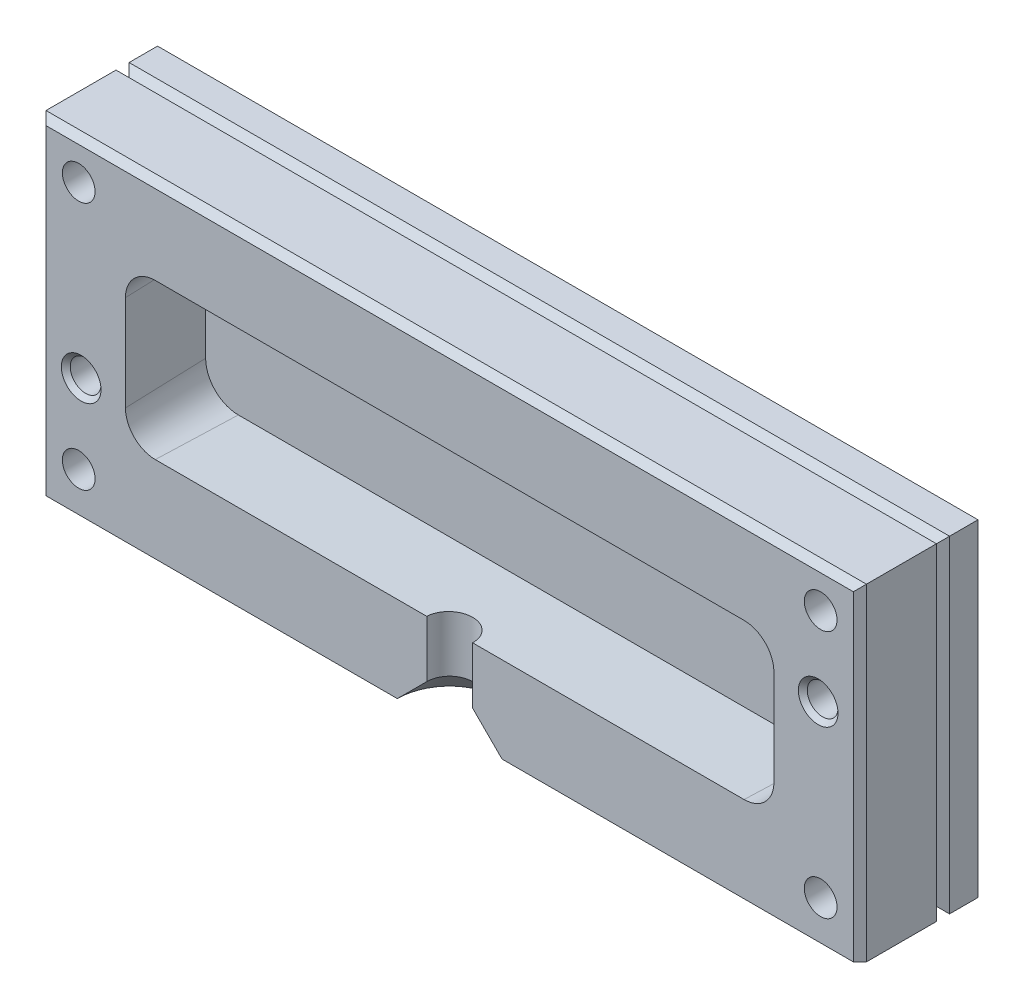
from build123d import *

# Parameters (mm, degrees)
MOLDSKETCH_W                         = 125.4
MOLDSKETCH_H                         = 50
MOLDEXTRUSION12_7MM_DEPTH            = 12.7
COVERSKETCH_W                        = 125.4
COVERSKETCH_H                        = 50
COVERTHICKNESS_DEPTH                 = 6.35
MOLD2DEGDRAFT_ANGLE                  = 2
F_6_0MM_DOWEL_HOLES_AT_2_COUNT       = 2
F_6_0MM_DOWEL_HOLES_AT_2_PITCH       = 113.456037741
CHAMFER1_SIZE                        = 1
SKETCH9_W                            = 2.5
SKETCH9_H                            = 12.7
TAP_DRILL_FOR_M6X1_0_TAP1_AT_2_COUNT = 2
TAP_DRILL_FOR_M6X1_0_TAP1_AT_2_PITCH = 113.4
TAP_DRILL_FOR_M6X1_0_TAP1_AT_3_COUNT = 2
TAP_DRILL_FOR_M6X1_0_TAP1_AT_3_PITCH = 119.597491612
TAP_DRILL_FOR_M6X1_0_TAP1_AT_4_COUNT = 2
TAP_DRILL_FOR_M6X1_0_TAP1_AT_4_PITCH = 38
COVERCHAMFER_SIZE                    = 1
SKETCH11_W                           = 2.5
SKETCH11_H                           = 6.35
TAP_DRILL_FOR_M6X1_0_TAP2_AT_2_COUNT = 2
TAP_DRILL_FOR_M6X1_0_TAP2_AT_2_PITCH = 113.4
TAP_DRILL_FOR_M6X1_0_TAP2_AT_3_COUNT = 2
TAP_DRILL_FOR_M6X1_0_TAP2_AT_3_PITCH = 119.597491612
TAP_DRILL_FOR_M6X1_0_TAP2_AT_4_COUNT = 2
TAP_DRILL_FOR_M6X1_0_TAP2_AT_4_PITCH = 38


with BuildPart() as part:
    # MoldSketch → MoldExtrusion12.7mm (new body)
    with BuildSketch(Plane.XY):
        Rectangle(MOLDSKETCH_W, MOLDSKETCH_H)
        with BuildLine():
            Line((-45, 12.3), (45, 12.3))
            ThreePointArc((45, 12.3), (48.535533906, 10.835533906), (50, 7.3))
            Line((50, 7.3), (50, -7.3))
            ThreePointArc((50, -7.3), (48.535533906, -10.835533906), (45, -12.3))
            Line((45, -12.3), (-45, -12.3))
            ThreePointArc((-45, -12.3), (-48.535533906, -10.835533906), (-50, -7.3))
            Line((-50, -7.3), (-50, 7.3))
            ThreePointArc((-50, 7.3), (-48.535533906, 10.835533906), (-45, 12.3))
        make_face(mode=Mode.SUBTRACT)
    extrude(amount=MOLDEXTRUSION12_7MM_DEPTH)

    # Mold2DegDraft
    mold2degdraft_faces = [part.faces().sort_by_distance(p)[0] for p in [
        (48.535533906, -10.835533906, 6.35),
        (50, 0, 6.35),
        (48.535533906, 10.835533906, 6.35),
        (0, 12.3, 6.35),
        (-48.535533906, 10.835533906, 6.35),
        (-50, 0, 6.35),
        (-48.535533906, -10.835533906, 6.35),
        (0, -12.3, 6.35),
    ]]
    draft(mold2degdraft_faces, Plane(origin=(0, 0, 0), x_dir=(-1, 0, 0), z_dir=(0, 0, -1)), MOLD2DEGDRAFT_ANGLE)

    # Sketch7 → Ø6.0mm Dowel Holes (revolve, cut)
    with BuildSketch(Plane(origin=(-56.325, -6.75, 12.7), x_dir=(0, -1, 0), z_dir=(1, 0, 0))):
        Polygon((0, 0), (0, 9.412022455), (2.35, 8), (2.35, 0.68), (3.03, 0), align=None)
    f_6_0mm_dowel_holes = revolve(axis=Axis((-56.325, -6.75, 19.05), (0, 0, -1)), mode=Mode.SUBTRACT)

    # Ø6.0mm Dowel Holes at 2: Ø6.0mm Dowel Holes ×2
    with Locations(*[Vector(0.9928955941213675, 0.11898881953518381, 0) * (i * F_6_0MM_DOWEL_HOLES_AT_2_PITCH) for i in range(1, F_6_0MM_DOWEL_HOLES_AT_2_COUNT)]):
        add(f_6_0mm_dowel_holes, mode=Mode.SUBTRACT)

    # InjectionHole → CSK for M6 Flat Head Machine Screw1 (revolve, cut)
    with BuildSketch(Plane(origin=(0, -25, 12.7), x_dir=(0, 0, -1), z_dir=(1, 0, 0))):
        Polygon((0, 0), (0, 13.143493773), (3.5, 13.143493773), (3.5, 4.5), (8, 0), align=None)
    revolve(axis=Axis((0, -31.35, 12.7), (0, 1, 0)), mode=Mode.SUBTRACT)

    # Chamfer1
    chamfer1_edges = [part.edges().sort_by_distance(p)[0] for p in [
        (-62.7, 0, 12.7),
        (62.7, 0, 12.7),
        (0, -25, 0),
        (-62.7, 0, 0),
        (0, 25, 0),
        (62.7, 0, 0),
        (0, 25, 12.7),
    ]]
    chamfer(chamfer1_edges, length=CHAMFER1_SIZE)

    # Sketch9 → Tap Drill for M6x1.0 Tap1 (revolve, cut)
    with BuildSketch(Plane(origin=(56.7, 19, 0), x_dir=(0, 1, 0), z_dir=(1, 0, 0))):
        with Locations((1.25, 6.35)):
            Rectangle(SKETCH9_W, SKETCH9_H)
    tap_drill_for_m6x1_0_tap1 = revolve(axis=Axis((56.7, 19, -6.35), (0, 0, 1)), mode=Mode.SUBTRACT)

    # Tap Drill for M6x1.0 Tap1 at 2: Tap Drill for M6x1.0 Tap1 ×2
    with Locations(*[(-i * TAP_DRILL_FOR_M6X1_0_TAP1_AT_2_PITCH, 0, 0) for i in range(1, TAP_DRILL_FOR_M6X1_0_TAP1_AT_2_COUNT)]):
        add(tap_drill_for_m6x1_0_tap1, mode=Mode.SUBTRACT)

    # Tap Drill for M6x1.0 Tap1 at 3: Tap Drill for M6x1.0 Tap1 ×2
    with Locations(*[Vector(-0.9481804214374986, -0.3177324163547175, 0) * (i * TAP_DRILL_FOR_M6X1_0_TAP1_AT_3_PITCH) for i in range(1, TAP_DRILL_FOR_M6X1_0_TAP1_AT_3_COUNT)]):
        add(tap_drill_for_m6x1_0_tap1, mode=Mode.SUBTRACT)

    # Tap Drill for M6x1.0 Tap1 at 4: Tap Drill for M6x1.0 Tap1 ×2
    with Locations(*[(0, -i * TAP_DRILL_FOR_M6X1_0_TAP1_AT_4_PITCH, 0) for i in range(1, TAP_DRILL_FOR_M6X1_0_TAP1_AT_4_COUNT)]):
        add(tap_drill_for_m6x1_0_tap1, mode=Mode.SUBTRACT)


with BuildPart() as body_2:
    # CoverSketch → CoverThickness (new body)
    with BuildSketch(Plane(origin=(0, 0, 0), x_dir=(-1, 0, 0), z_dir=(0, 0, -1))):
        Rectangle(COVERSKETCH_W, COVERSKETCH_H)
    extrude(amount=COVERTHICKNESS_DEPTH)

    # CoverChamfer
    coverchamfer_edges = [body_2.edges().sort_by_distance(p)[0] for p in [
        (-62.7, 0, -6.35),
        (0, 25, -6.35),
        (62.7, 0, -6.35),
        (0, 25, 0),
        (-62.7, 0, 0),
        (0, -25, 0),
        (62.7, 0, 0),
        (0, -25, -6.35),
    ]]
    chamfer(coverchamfer_edges, length=COVERCHAMFER_SIZE)

    # Sketch11 → Tap Drill for M6x1.0 Tap2 (revolve, cut)
    with BuildSketch(Plane(origin=(-56.7, 19, 0), x_dir=(0, -1, 0), z_dir=(1, 0, 0))):
        with Locations((1.25, 3.175)):
            Rectangle(SKETCH11_W, SKETCH11_H)
    tap_drill_for_m6x1_0_tap2 = revolve(axis=Axis((-56.7, 19, 6.35), (0, 0, -1)), mode=Mode.SUBTRACT)

    # Tap Drill for M6x1.0 Tap2 at 2: Tap Drill for M6x1.0 Tap2 ×2
    with Locations(*[(i * TAP_DRILL_FOR_M6X1_0_TAP2_AT_2_PITCH, 0, 0) for i in range(1, TAP_DRILL_FOR_M6X1_0_TAP2_AT_2_COUNT)]):
        add(tap_drill_for_m6x1_0_tap2, mode=Mode.SUBTRACT)

    # Tap Drill for M6x1.0 Tap2 at 3: Tap Drill for M6x1.0 Tap2 ×2
    with Locations(*[Vector(0.9481804214374986, -0.3177324163547175, 0) * (i * TAP_DRILL_FOR_M6X1_0_TAP2_AT_3_PITCH) for i in range(1, TAP_DRILL_FOR_M6X1_0_TAP2_AT_3_COUNT)]):
        add(tap_drill_for_m6x1_0_tap2, mode=Mode.SUBTRACT)

    # Tap Drill for M6x1.0 Tap2 at 4: Tap Drill for M6x1.0 Tap2 ×2
    with Locations(*[(0, -i * TAP_DRILL_FOR_M6X1_0_TAP2_AT_4_PITCH, 0) for i in range(1, TAP_DRILL_FOR_M6X1_0_TAP2_AT_4_COUNT)]):
        add(tap_drill_for_m6x1_0_tap2, mode=Mode.SUBTRACT)


solid = Compound([part.part, body_2.part])
